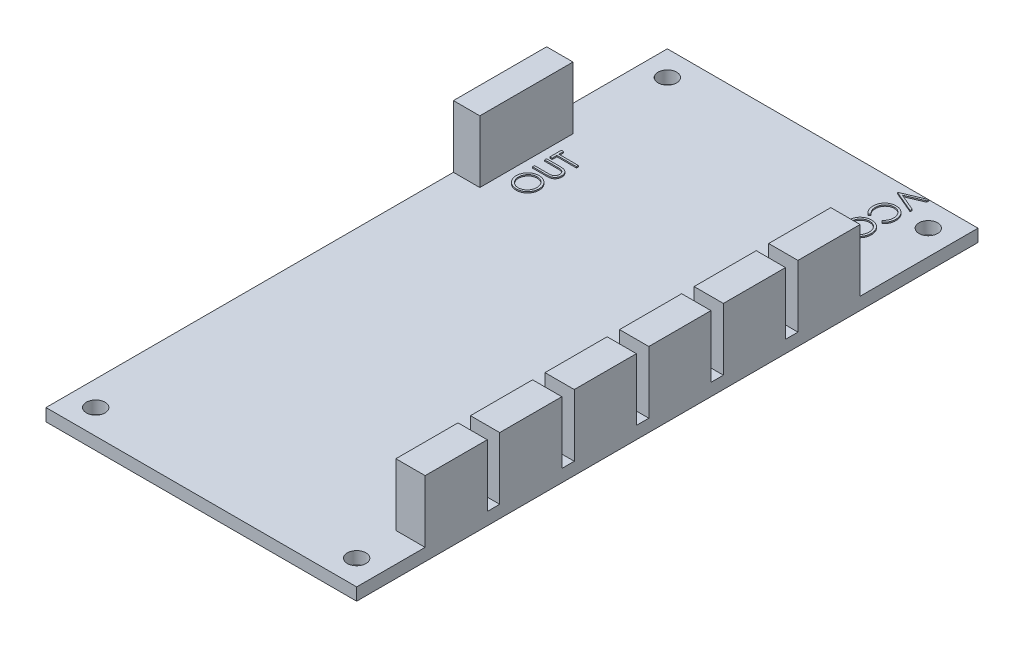
from build123d import *

# Parameters (mm, degrees)
SKIZZE1_W                       = 50
SKIZZE1_H                       = 100
SKIZZE1_R                       = 1.5
AUFSATZ_LINEAR_AUSTRAGEN1_DEPTH = 2
SKIZZE2_W                       = 4.251019897
SKIZZE2_H                       = 15
SKIZZE2_W_2                     = 4.710285564
SKIZZE2_H_2                     = 10
AUFSATZ_LINEAR_AUSTRAGEN2_DEPTH = 10
SKIZZE3_W                       = 3.5
SKIZZE3_H                       = 0.314102564
AUFSATZ_LINEAR_AUSTRAGEN3_DEPTH = 0.2


with BuildPart() as part:
    # Skizze1 → Aufsatz-Linear austragen1 (new body)
    with BuildSketch(Plane(origin=(0, 0, 0), x_dir=(1, 0, 0), z_dir=(0, 1, 0))):
        Rectangle(SKIZZE1_W, SKIZZE1_H)
        with Locations(Location((-21, -46, 0), (0, 0, 270))):
            Circle(SKIZZE1_R, mode=Mode.SUBTRACT)
        with Locations(Location((21, -46, 0), (0, 0, 270))):
            Circle(SKIZZE1_R, mode=Mode.SUBTRACT)
        with Locations(Location((-21, 46, 0), (0, 0, 90))):
            Circle(SKIZZE1_R, mode=Mode.SUBTRACT)
        with Locations(Location((21, 46, 0), (0, 0, 90))):
            Circle(SKIZZE1_R, mode=Mode.SUBTRACT)
    extrude(amount=AUFSATZ_LINEAR_AUSTRAGEN1_DEPTH)

    # Skizze2 → Aufsatz-Linear austragen2 (add)
    with BuildSketch(Plane(origin=(0, 2, 0), x_dir=(1, 0, 0), z_dir=(0, 1, 0))):
        with Locations((-22.874490052, 23.070720831)):
            Rectangle(SKIZZE2_W, SKIZZE2_H)
        with Locations((22.644857218, 26.019961823)):
            Rectangle(SKIZZE2_W_2, SKIZZE2_H_2)
        with Locations((22.644857218, 14.019961823)):
            Rectangle(SKIZZE2_W_2, SKIZZE2_H_2)
        with Locations((22.644857218, 2.019961823)):
            Rectangle(SKIZZE2_W_2, SKIZZE2_H_2)
        with Locations((22.644857218, -9.980038177)):
            Rectangle(SKIZZE2_W_2, SKIZZE2_H_2)
        with Locations((22.644857218, -21.980038177)):
            Rectangle(SKIZZE2_W_2, SKIZZE2_H_2)
        with Locations((22.644857218, -33.980038177)):
            Rectangle(SKIZZE2_W_2, SKIZZE2_H_2)
    extrude(amount=AUFSATZ_LINEAR_AUSTRAGEN2_DEPTH)

    # Skizze3 → Aufsatz-Linear austragen3 (add)
    # profile 1 of 23: a face of its own
    with BuildSketch(Plane(origin=(0, 2, 0), x_dir=(1, 0, 0), z_dir=(0, 1, 0))):
        Polygon((17.25727226, 49.820512821), (17.25727226, 49.483974359), (14.499059119, 48.317307692), (17.25727226, 47.150641026), (17.25727226, 46.814102564), (13.75727226, 48.294871795), (13.75727226, 48.33974359), align=None)
    # profile 2 of 23: a face of its own
    with BuildSketch(Plane(origin=(0, 2, 0), x_dir=(1, 0, 0), z_dir=(0, 1, 0))):
        with BuildLine():
            Line((16.615044695, 42.91025641), (16.404708157, 43.185096154))
            add(Edge.make_bspline(
                [(16.404708157, 43.185096154), (16.428074127, 43.204702042), (16.474491043, 43.243649489), (16.539670587, 43.306308692), (16.600735848, 43.371610334), (16.657977728, 43.439529456), (16.709394494, 43.511288575), (16.757665597, 43.585149374), (16.800933335, 43.662347419), (16.853396321, 43.769099154), (16.908142476, 43.908747002), (16.954045707, 44.084541841), (16.983266883, 44.26805294), (16.986431724, 44.393250539), (16.98804149, 44.45693109)],
                knots=[0, 0, 0, 0, 0.757959112, 1.505699292, 2.245454638, 2.979532153, 3.711538275, 4.438200793, 5.171680507, 5.909471876, 7.393775596, 8.890124382, 10.418191784, 12, 12, 12, 12], degree=3))
            add(Edge.make_bspline(
                [(16.98804149, 44.45693109), (16.987635705, 44.492013963), (16.986827901, 44.561854106), (16.976245676, 44.665508873), (16.961200939, 44.767424406), (16.93942056, 44.867221717), (16.911064482, 44.964702655), (16.877810371, 45.060609455), (16.836429005, 45.153812591), (16.790728811, 45.24543374), (16.739095991, 45.333208898), (16.682795727, 45.416276875), (16.622380598, 45.494258173), (16.558006554, 45.56736888), (16.488873555, 45.634807178), (16.415794868, 45.697653868), (16.337890901, 45.754776303), (16.256622678, 45.807578169), (16.171870749, 45.854562385), (16.084168275, 45.895135531), (15.993850575, 45.92991009), (15.900732626, 45.957681441), (15.805180871, 45.97958644), (15.706992527, 45.994719409), (15.606358183, 46.005206438), (15.53814896, 46.006006811), (15.503766651, 46.006410256)],
                knots=[0, 0, 0, 0, 1.055000685, 2.100209969, 3.131349012, 4.153242145, 5.170189196, 6.184191144, 7.204341339, 8.235672124, 9.263040994, 10.265373269, 11.252624173, 12.22887325, 13.193405896, 14.155809299, 15.126090485, 16.097288279, 17.069732292, 18.038585918, 19.002221264, 19.978698174, 20.959418239, 21.948869816, 22.966084182, 24, 24, 24, 24], degree=3))
            add(Edge.make_bspline(
                [(15.503766651, 46.006410256), (15.452035331, 46.005148437), (15.350467746, 46.002671023), (15.201697135, 45.980622689), (15.059176461, 45.947117598), (14.923796619, 45.896902021), (14.793888261, 45.83498297), (14.671649408, 45.756742359), (14.555232843, 45.666125821), (14.447389895, 45.561851402), (14.34887617, 45.447445586), (14.262125589, 45.324697674), (14.189810706, 45.193913387), (14.12963476, 45.056536756), (14.083378032, 44.911510642), (14.050813908, 44.75909584), (14.029571728, 44.599623845), (14.02753804, 44.490654445), (14.026503029, 44.435196314)],
                knots=[0, 0, 0, 0, 1.029171465, 2.020641659, 2.987623507, 3.938342917, 4.889210282, 5.84687017, 6.821220943, 7.821438502, 8.827599549, 9.822697543, 10.807740252, 11.797342354, 12.80366471, 13.83203677, 14.896651826, 16, 16, 16, 16], degree=3))
            add(Edge.make_bspline(
                [(14.026503029, 44.435196314), (14.028191809, 44.374093625), (14.031515731, 44.253828916), (14.05967498, 44.07746089), (14.105332898, 43.908625124), (14.16923082, 43.747312538), (14.252296108, 43.593977891), (14.352993986, 43.448381231), (14.472282318, 43.310399661), (14.563365447, 43.227428378), (14.609836362, 43.185096154)],
                knots=[0, 0, 0, 0, 1.028121516, 2.023589091, 2.998037872, 3.967518031, 4.937445131, 5.927275754, 6.942489185, 8, 8, 8, 8], degree=3))
            Line((14.609836362, 43.185096154), (14.401603189, 42.91025641))
            add(Edge.make_bspline(
                [(14.401603189, 42.91025641), (14.373064688, 42.932374491), (14.316124385, 42.976504707), (14.235853399, 43.04796316), (14.16034666, 43.123238831), (14.090229095, 43.202900593), (14.024036926, 43.285995692), (13.963989192, 43.373987806), (13.908256744, 43.46535714), (13.857900309, 43.56063566), (13.812750239, 43.659510554), (13.774633302, 43.761878925), (13.741326209, 43.866873502), (13.71410599, 43.974547161), (13.692826271, 44.08525961), (13.678608967, 44.198630992), (13.668866413, 44.314900622), (13.667978584, 44.393342077), (13.66752867, 44.433092949)],
                knots=[0, 0, 0, 0, 0.986756325, 1.968786143, 2.935506311, 3.899499537, 4.868307269, 5.8376204, 6.809456583, 7.792545619, 8.781780509, 9.778496008, 10.776623214, 11.79151764, 12.812666265, 13.856269958, 14.913646641, 16, 16, 16, 16], degree=3))
            add(Edge.make_bspline(
                [(13.66752867, 44.433092949), (13.667790662, 44.470736616), (13.66830872, 44.545172306), (13.676700888, 44.655071057), (13.688150625, 44.762060638), (13.705390756, 44.865835264), (13.725735096, 44.966961239), (13.753006352, 45.064521824), (13.783555519, 45.159477034), (13.819460506, 45.251445375), (13.859976688, 45.340505075), (13.905768247, 45.426368886), (13.956450112, 45.508997318), (14.010905122, 45.589202739), (14.070882424, 45.665800323), (14.135549059, 45.739453848), (14.204687069, 45.810576324), (14.254541923, 45.854579009), (14.279607997, 45.876702724)],
                knots=[0, 0, 0, 0, 1.114604814, 2.203992996, 3.262667896, 4.300477797, 5.318619304, 6.316056647, 7.298880507, 8.271930387, 9.238335007, 10.195173496, 11.151986948, 12.108099108, 13.064862484, 14.031167946, 15.010108607, 16, 16, 16, 16], degree=3))
            add(Edge.make_bspline(
                [(14.279607997, 45.876702724), (14.323149186, 45.912138368), (14.409705896, 45.982581845), (14.549991877, 46.072707528), (14.696460086, 46.149855083), (14.849880015, 46.212231004), (15.009907402, 46.260993737), (15.176622917, 46.294774932), (15.349870859, 46.316726537), (15.467707647, 46.319236826), (15.527604792, 46.320512821)],
                knots=[0, 0, 0, 0, 0.994628077, 1.977248131, 2.950237994, 3.925870899, 4.908910175, 5.911660606, 6.938484602, 8, 8, 8, 8], degree=3))
            add(Edge.make_bspline(
                [(15.527604792, 46.320512821), (15.590557611, 46.318950671), (15.714413354, 46.315877239), (15.8962249, 46.289980724), (16.070162568, 46.247816194), (16.236895627, 46.189755356), (16.395470094, 46.113157586), (16.546555697, 46.020429791), (16.69002907, 45.910666245), (16.824055891, 45.785245472), (16.946591979, 45.647670889), (17.054399036, 45.50035397), (17.144116327, 45.343571524), (17.21911255, 45.179053806), (17.276756997, 45.005568088), (17.317110188, 44.823484729), (17.342227303, 44.633145812), (17.345402511, 44.503283386), (17.347015849, 44.437299679)],
                knots=[0, 0, 0, 0, 1.032901378, 2.032168977, 3.007206631, 3.966850309, 4.924221947, 5.891988639, 6.871730993, 7.884084801, 8.900290346, 9.89161143, 10.874607481, 11.860025555, 12.854717796, 13.869097222, 14.917278314, 16, 16, 16, 16], degree=3))
            add(Edge.make_bspline(
                [(17.347015849, 44.437299679), (17.346534071, 44.397085129), (17.345580441, 44.317484475), (17.336269076, 44.199732965), (17.32077467, 44.085086439), (17.299546287, 43.973267641), (17.273527405, 43.863871092), (17.239466678, 43.75801912), (17.199913825, 43.65513532), (17.155521419, 43.555142639), (17.104770729, 43.459128967), (17.049650159, 43.367111776), (16.988887342, 43.280201087), (16.9244911, 43.196762102), (16.85405259, 43.118673297), (16.779865697, 43.043704477), (16.699729035, 42.974445345), (16.643324482, 42.931691889), (16.615044695, 42.91025641)],
                knots=[0, 0, 0, 0, 1.096705196, 2.170817488, 3.219277236, 4.250701065, 5.274195539, 6.284202015, 7.28098643, 8.279664616, 9.266225751, 10.241373748, 11.203306326, 12.157093976, 13.114198862, 14.069774147, 15.032234603, 16, 16, 16, 16], degree=3))
        make_face()
    # profile 3 of 23: a face of its own
    with BuildSketch(Plane(origin=(0, 2, 0), x_dir=(1, 0, 0), z_dir=(0, 1, 0))):
        with BuildLine():
            Line((16.615044695, 38.961538462), (16.404708157, 39.236378205))
            add(Edge.make_bspline(
                [(16.404708157, 39.236378205), (16.428074127, 39.255984093), (16.474491043, 39.29493154), (16.539670587, 39.357590743), (16.600735848, 39.422892386), (16.657977728, 39.490811507), (16.709394494, 39.562570626), (16.757665597, 39.636431425), (16.800933335, 39.71362947), (16.853396321, 39.820381205), (16.908142476, 39.960029053), (16.954045707, 40.135823892), (16.983266883, 40.319334991), (16.986431724, 40.44453259), (16.98804149, 40.508213141)],
                knots=[0, 0, 0, 0, 0.757959112, 1.505699292, 2.245454638, 2.979532153, 3.711538275, 4.438200793, 5.171680507, 5.909471876, 7.393775596, 8.890124382, 10.418191784, 12, 12, 12, 12], degree=3))
            add(Edge.make_bspline(
                [(16.98804149, 40.508213141), (16.987635705, 40.543296014), (16.986827901, 40.613136158), (16.976245676, 40.716790925), (16.961200939, 40.818706457), (16.93942056, 40.918503769), (16.911064482, 41.015984706), (16.877810371, 41.111891506), (16.836429005, 41.205094642), (16.790728811, 41.296715791), (16.739095991, 41.384490949), (16.682795727, 41.467558927), (16.622380598, 41.545540225), (16.558006554, 41.618650931), (16.488873555, 41.68608923), (16.415794868, 41.748935919), (16.337890901, 41.806058355), (16.256622678, 41.85886022), (16.171870749, 41.905844436), (16.084168275, 41.946417582), (15.993850575, 41.981192141), (15.900732626, 42.008963492), (15.805180871, 42.030868492), (15.706992527, 42.046001461), (15.606358183, 42.056488489), (15.53814896, 42.057288862), (15.503766651, 42.057692308)],
                knots=[0, 0, 0, 0, 1.055000685, 2.100209969, 3.131349012, 4.153242145, 5.170189196, 6.184191144, 7.204341339, 8.235672124, 9.263040994, 10.265373269, 11.252624173, 12.22887325, 13.193405896, 14.155809299, 15.126090485, 16.097288279, 17.069732292, 18.038585918, 19.002221264, 19.978698174, 20.959418239, 21.948869816, 22.966084182, 24, 24, 24, 24], degree=3))
            add(Edge.make_bspline(
                [(15.503766651, 42.057692308), (15.452035331, 42.056430489), (15.350467746, 42.053953074), (15.201697135, 42.03190474), (15.059176461, 41.998399649), (14.923796619, 41.948184072), (14.793888261, 41.886265022), (14.671649408, 41.80802441), (14.555232843, 41.717407873), (14.447389895, 41.613133453), (14.34887617, 41.498727637), (14.262125589, 41.375979726), (14.189810706, 41.245195438), (14.12963476, 41.107818808), (14.083378032, 40.962792694), (14.050813908, 40.810377891), (14.029571728, 40.650905896), (14.02753804, 40.541936496), (14.026503029, 40.486478365)],
                knots=[0, 0, 0, 0, 1.029171465, 2.020641659, 2.987623507, 3.938342917, 4.889210282, 5.84687017, 6.821220943, 7.821438502, 8.827599549, 9.822697543, 10.807740252, 11.797342354, 12.80366471, 13.83203677, 14.896651826, 16, 16, 16, 16], degree=3))
            add(Edge.make_bspline(
                [(14.026503029, 40.486478365), (14.028191809, 40.425375676), (14.031515731, 40.305110967), (14.05967498, 40.128742941), (14.105332898, 39.959907176), (14.16923082, 39.798594589), (14.252296108, 39.645259943), (14.352993986, 39.499663282), (14.472282318, 39.361681712), (14.563365447, 39.27871043), (14.609836362, 39.236378205)],
                knots=[0, 0, 0, 0, 1.028121516, 2.023589091, 2.998037872, 3.967518031, 4.937445131, 5.927275754, 6.942489185, 8, 8, 8, 8], degree=3))
            Line((14.609836362, 39.236378205), (14.401603189, 38.961538462))
            add(Edge.make_bspline(
                [(14.401603189, 38.961538462), (14.373064688, 38.983656542), (14.316124385, 39.027786759), (14.235853399, 39.099245211), (14.16034666, 39.174520882), (14.090229095, 39.254182644), (14.024036926, 39.337277743), (13.963989192, 39.425269857), (13.908256744, 39.516639191), (13.857900309, 39.611917711), (13.812750239, 39.710792605), (13.774633302, 39.813160976), (13.741326209, 39.918155553), (13.71410599, 40.025829212), (13.692826271, 40.136541661), (13.678608967, 40.249913044), (13.668866413, 40.366182674), (13.667978584, 40.444624128), (13.66752867, 40.484375)],
                knots=[0, 0, 0, 0, 0.986756325, 1.968786143, 2.935506311, 3.899499537, 4.868307269, 5.8376204, 6.809456583, 7.792545619, 8.781780509, 9.778496008, 10.776623214, 11.79151764, 12.812666265, 13.856269958, 14.913646641, 16, 16, 16, 16], degree=3))
            add(Edge.make_bspline(
                [(13.66752867, 40.484375), (13.667790662, 40.522018667), (13.66830872, 40.596454357), (13.676700888, 40.706353109), (13.688150625, 40.81334269), (13.705390756, 40.917117315), (13.725735096, 41.01824329), (13.753006352, 41.115803875), (13.783555519, 41.210759085), (13.819460506, 41.302727426), (13.859976688, 41.391787126), (13.905768247, 41.477650937), (13.956450112, 41.56027937), (14.010905122, 41.64048479), (14.070882424, 41.717082374), (14.135549059, 41.790735899), (14.204687069, 41.861858376), (14.254541923, 41.905861061), (14.279607997, 41.927984776)],
                knots=[0, 0, 0, 0, 1.114604814, 2.203992996, 3.262667896, 4.300477797, 5.318619304, 6.316056647, 7.298880507, 8.271930387, 9.238335007, 10.195173496, 11.151986948, 12.108099108, 13.064862484, 14.031167946, 15.010108607, 16, 16, 16, 16], degree=3))
            add(Edge.make_bspline(
                [(14.279607997, 41.927984776), (14.323149186, 41.963420419), (14.409705896, 42.033863896), (14.549991877, 42.12398958), (14.696460086, 42.201137135), (14.849880015, 42.263513056), (15.009907402, 42.312275789), (15.176622917, 42.346056984), (15.349870859, 42.368008588), (15.467707647, 42.370518877), (15.527604792, 42.371794872)],
                knots=[0, 0, 0, 0, 0.994628077, 1.977248131, 2.950237994, 3.925870899, 4.908910175, 5.911660606, 6.938484602, 8, 8, 8, 8], degree=3))
            add(Edge.make_bspline(
                [(15.527604792, 42.371794872), (15.590557611, 42.370232722), (15.714413354, 42.367159291), (15.8962249, 42.341262775), (16.070162568, 42.299098246), (16.236895627, 42.241037407), (16.395470094, 42.164439637), (16.546555697, 42.071711843), (16.69002907, 41.961948296), (16.824055891, 41.836527523), (16.946591979, 41.698952941), (17.054399036, 41.551636022), (17.144116327, 41.394853575), (17.21911255, 41.230335857), (17.276756997, 41.056850139), (17.317110188, 40.87476678), (17.342227303, 40.684427863), (17.345402511, 40.554565438), (17.347015849, 40.488581731)],
                knots=[0, 0, 0, 0, 1.032901378, 2.032168977, 3.007206631, 3.966850309, 4.924221947, 5.891988639, 6.871730993, 7.884084801, 8.900290346, 9.89161143, 10.874607481, 11.860025555, 12.854717796, 13.869097222, 14.917278314, 16, 16, 16, 16], degree=3))
            add(Edge.make_bspline(
                [(17.347015849, 40.488581731), (17.346534071, 40.44836718), (17.345580441, 40.368766527), (17.336269076, 40.251015016), (17.32077467, 40.136368491), (17.299546287, 40.024549692), (17.273527405, 39.915153144), (17.239466678, 39.809301171), (17.199913825, 39.706417372), (17.155521419, 39.606424691), (17.104770729, 39.510411018), (17.049650159, 39.418393828), (16.988887342, 39.331483138), (16.9244911, 39.248044153), (16.85405259, 39.169955349), (16.779865697, 39.094986528), (16.699729035, 39.025727397), (16.643324482, 38.98297394), (16.615044695, 38.961538462)],
                knots=[0, 0, 0, 0, 1.096705196, 2.170817488, 3.219277236, 4.250701065, 5.274195539, 6.284202015, 7.28098643, 8.279664616, 9.266225751, 10.241373748, 11.203306326, 12.157093976, 13.114198862, 14.069774147, 15.032234603, 16, 16, 16, 16], degree=3))
        make_face()
    # profile 4 of 23: a face of its own
    with BuildSketch(Plane(origin=(0, 2, 0), x_dir=(1, 0, 0), z_dir=(0, 1, 0))):
        Polygon((13.75727226, 20.872752432), (17.25727226, 20.410713169), (17.25727226, 20.365841374), (14.385477388, 18.920829355), (17.25727226, 17.479322945), (17.25727226, 17.433750028), (13.75727226, 16.968906278), (13.75727226, 17.284411086), (16.275701747, 17.619547304), (13.75727226, 18.882968778), (13.75727226, 18.95378208), (16.281310721, 20.222111407), (13.75727226, 20.556546503), align=None)
    # profile 5 of 23: a face of its own
    with BuildSketch(Plane(origin=(0, 2, 0), x_dir=(1, 0, 0), z_dir=(0, 1, 0))):
        Polygon((17.25727226, 16.25095756), (17.25727226, 14.276598586), (16.898297901, 14.276598586), (16.898297901, 15.936854996), (15.821374824, 15.936854996), (15.821374824, 14.276598586), (15.462400465, 14.276598586), (15.462400465, 15.936854996), (14.116246619, 15.936854996), (14.116246619, 14.276598586), (13.75727226, 14.276598586), (13.75727226, 16.25095756), align=None)
    # profile 6 of 23: a face of its own
    with BuildSketch(Plane(origin=(0, 2, 0), x_dir=(1, 0, 0), z_dir=(0, 1, 0))):
        Polygon((17.25727226, 12.212496022), (13.75727226, 10.597111407), (13.75727226, 10.938557721), (14.879067131, 11.455985605), (14.879067131, 13.042624227), (13.75727226, 13.574775669), (13.75727226, 13.917624227), (17.25727226, 12.257367817), align=None)
        Polygon((16.575080753, 12.238437528), (15.23804149, 12.872251631), (15.23804149, 11.621450349), align=None, mode=Mode.SUBTRACT)
    # profile 7 of 23: a face of its own
    with BuildSketch(Plane(origin=(0, 2, 0), x_dir=(1, 0, 0), z_dir=(0, 1, 0))):
        with BuildLine():
            Line((14.432452548, 10.417624227), (14.609836362, 10.12175083))
            add(Edge.make_bspline(
                [(14.609836362, 10.12175083), (14.563771977, 10.094232592), (14.475514393, 10.041508712), (14.356256353, 9.953557353), (14.254894196, 9.862424441), (14.172017589, 9.767435108), (14.106768702, 9.66916916), (14.06056647, 9.566985106), (14.031750495, 9.461227295), (14.028250408, 9.389253474), (14.026503029, 9.353321342)],
                knots=[0, 0, 0, 0, 1.272034388, 2.437168799, 3.508375237, 4.49857839, 5.41946034, 6.295179144, 7.148887113, 8, 8, 8, 8], degree=3))
            add(Edge.make_bspline(
                [(14.026503029, 9.353321342), (14.0273577, 9.322634479), (14.029052088, 9.261797699), (14.045332906, 9.172235503), (14.070344976, 9.085253525), (14.106166129, 9.002645543), (14.149503814, 8.925547561), (14.201852804, 8.857949186), (14.260449031, 8.79947355), (14.325867977, 8.751771805), (14.39598089, 8.714740631), (14.46859225, 8.687943849), (14.543382665, 8.670889309), (14.594088308, 8.668718608), (14.619652067, 8.667624227)],
                knots=[0, 0, 0, 0, 1.095270387, 2.171376115, 3.241375676, 4.322296363, 5.380636668, 6.392615365, 7.366724986, 8.328592944, 9.273498763, 10.190095884, 11.087518669, 12, 12, 12, 12], degree=3))
            add(Edge.make_bspline(
                [(14.619652067, 8.667624227), (14.648792917, 8.669098538), (14.708032006, 8.672095596), (14.795431659, 8.697427076), (14.881924229, 8.737276323), (14.935425495, 8.774038967), (14.963201747, 8.793125028)],
                knots=[0, 0, 0, 0, 0.938893495, 1.908633276, 2.914225137, 4, 4, 4, 4], degree=3))
            add(Edge.make_bspline(
                [(14.963201747, 8.793125028), (14.983289551, 8.808751279), (15.025585173, 8.841652935), (15.087490643, 8.898999622), (15.152906486, 8.964541344), (15.221567062, 9.03860576), (15.292218458, 9.122665118), (15.36633341, 9.21499336), (15.443689175, 9.316068432), (15.494843787, 9.387301575), (15.521294695, 9.424134644)],
                knots=[0, 0, 0, 0, 0.72226686, 1.520759855, 2.393439377, 3.351307446, 4.386958158, 5.510256019, 6.712608938, 8, 8, 8, 8], degree=3))
            add(Edge.make_bspline(
                [(15.521294695, 9.424134644), (15.547529286, 9.460953728), (15.597687827, 9.531349013), (15.672034499, 9.629871097), (15.740441652, 9.717853407), (15.801956399, 9.795744257), (15.859261702, 9.861528511), (15.909286317, 9.917611058), (15.954701501, 9.961922801), (15.984139471, 9.98658124), (15.997356394, 9.997652272)],
                knots=[0, 0, 0, 0, 1.452255772, 2.776602448, 3.96446981, 5.032613149, 5.964194703, 6.766668629, 7.446264616, 8, 8, 8, 8], degree=3))
            add(Edge.make_bspline(
                [(15.997356394, 9.997652272), (16.017957431, 10.013124817), (16.058472135, 10.043553654), (16.121796993, 10.083719659), (16.186620258, 10.117858822), (16.253116123, 10.144621154), (16.320351051, 10.167157373), (16.389202297, 10.182315304), (16.459360916, 10.191806701), (16.506574416, 10.192778687), (16.530208958, 10.193265253)],
                knots=[0, 0, 0, 0, 1.068054152, 2.10047183, 3.106115577, 4.101338837, 5.06977816, 6.043150881, 7.020423561, 8, 8, 8, 8], degree=3))
            add(Edge.make_bspline(
                [(16.530208958, 10.193265253), (16.567241833, 10.191965737), (16.640516032, 10.189394482), (16.747501879, 10.167471361), (16.849956506, 10.13327274), (16.94562315, 10.083811522), (17.034278093, 10.022659143), (17.114566833, 9.950386636), (17.182637763, 9.864578942), (17.241422928, 9.769906359), (17.287836275, 9.666948661), (17.323033871, 9.559254678), (17.342711482, 9.446352167), (17.345566962, 9.369752531), (17.347015849, 9.330885445)],
                knots=[0, 0, 0, 0, 1.005541892, 1.989591032, 2.955705311, 3.932863626, 4.905387107, 5.876519979, 6.856563935, 7.871847665, 8.897921447, 9.918317993, 10.943742853, 12, 12, 12, 12], degree=3))
            add(Edge.make_bspline(
                [(17.347015849, 9.330885445), (17.345619946, 9.289635197), (17.342851702, 9.207831022), (17.317920686, 9.087274975), (17.277649202, 8.970981204), (17.23126622, 8.877370416), (17.185148328, 8.80423329), (17.143125509, 8.748461524), (17.09475129, 8.691943786), (17.039891781, 8.634225816), (16.978045107, 8.576285131), (16.909634396, 8.517261686), (16.835077846, 8.457017415), (16.781853345, 8.418261556), (16.754567933, 8.398393458)],
                knots=[0, 0, 0, 0, 1.286821612, 2.551921131, 3.825787379, 5.12137259, 5.803616487, 6.523126609, 7.299589446, 8.125436757, 9.008162487, 9.944516264, 10.946261234, 12, 12, 12, 12], degree=3))
            Line((16.754567933, 8.398393458), (16.539323542, 8.682347785))
            add(Edge.make_bspline(
                [(16.539323542, 8.682347785), (16.561412233, 8.699493717), (16.603949887, 8.732512774), (16.663521194, 8.782642263), (16.717937702, 8.829890902), (16.765202738, 8.876441331), (16.80790517, 8.919834868), (16.844463945, 8.961952222), (16.875242729, 9.002185558), (16.908072981, 9.052906707), (16.940823586, 9.116792269), (16.967946678, 9.196908021), (16.984832693, 9.280403106), (16.986960134, 9.337115296), (16.98804149, 9.365941535)],
                knots=[0, 0, 0, 0, 1.181667846, 2.275615987, 3.290305621, 4.226321945, 5.078535498, 5.862783384, 6.581873284, 7.217493746, 8.414623899, 9.604724551, 10.782505457, 12, 12, 12, 12], degree=3))
            add(Edge.make_bspline(
                [(16.98804149, 9.365941535), (16.98682979, 9.402098057), (16.984493141, 9.471822505), (16.958973156, 9.570812741), (16.918791296, 9.659906666), (16.862476317, 9.736459231), (16.795755325, 9.800196208), (16.71897647, 9.846301667), (16.634194067, 9.874051831), (16.575052411, 9.877438111), (16.544932516, 9.879162689)],
                knots=[0, 0, 0, 0, 1.14458467, 2.207223713, 3.21896685, 4.227309161, 5.202851033, 6.127160689, 7.046193047, 8, 8, 8, 8], degree=3))
            add(Edge.make_bspline(
                [(16.544932516, 9.879162689), (16.526185818, 9.87875126), (16.488661768, 9.877927732), (16.43307713, 9.867216858), (16.377985898, 9.852029161), (16.323143103, 9.829801032), (16.267258527, 9.79986074), (16.210483052, 9.759150944), (16.151383232, 9.708221312), (16.112983081, 9.669131737), (16.092708958, 9.648493618)],
                knots=[0, 0, 0, 0, 0.858526328, 1.718456515, 2.587092892, 3.476767204, 4.426280253, 5.487868114, 6.673670035, 8, 8, 8, 8], degree=3))
            add(Edge.make_bspline(
                [(16.092708958, 9.648493618), (16.085871932, 9.640832246), (16.069628724, 9.622630579), (16.043036443, 9.589354653), (16.010233671, 9.545411855), (15.969646355, 9.491949653), (15.922564893, 9.427982292), (15.86959128, 9.353502736), (15.809005821, 9.269341203), (15.766648281, 9.209619287), (15.744251426, 9.178040894)],
                knots=[0, 0, 0, 0, 0.420754252, 0.999615792, 1.744751191, 2.668019286, 3.750313428, 4.999500688, 6.413464383, 8, 8, 8, 8], degree=3))
            add(Edge.make_bspline(
                [(15.744251426, 9.178040894), (15.716610067, 9.14005498), (15.663086405, 9.066500524), (15.582670725, 8.961842944), (15.504022956, 8.866949136), (15.427645349, 8.781485932), (15.354117256, 8.704609024), (15.282554076, 8.637171303), (15.213468503, 8.578485623), (15.124895928, 8.515306405), (15.016114843, 8.450748585), (14.882836605, 8.395307078), (14.749040284, 8.36034873), (14.659113448, 8.355777215), (14.614744215, 8.353521663)],
                knots=[0, 0, 0, 0, 1.163667725, 2.253281268, 3.268753668, 4.215851969, 5.092017293, 5.902905408, 6.650798638, 7.335211899, 8.59617414, 9.77448103, 10.901945474, 12, 12, 12, 12], degree=3))
            add(Edge.make_bspline(
                [(14.614744215, 8.353521663), (14.583366097, 8.354179166), (14.521219203, 8.355481404), (14.429960529, 8.370437009), (14.341343038, 8.392376417), (14.256381823, 8.425339714), (14.173940033, 8.465887682), (14.094777074, 8.515970242), (14.019981188, 8.576344737), (13.947995881, 8.643448542), (13.882972454, 8.718023173), (13.824816281, 8.796654985), (13.776139929, 8.879854464), (13.736955341, 8.967218915), (13.705822982, 9.058265056), (13.683445694, 9.153088702), (13.66968033, 9.25195391), (13.668253897, 9.319154984), (13.66752867, 9.353321342)],
                knots=[0, 0, 0, 0, 0.983610584, 1.948120116, 2.894308362, 3.843560551, 4.801159957, 5.773581695, 6.77566113, 7.813174769, 8.857584665, 9.875476876, 10.877851407, 11.875574773, 12.875048225, 13.892438445, 14.928473903, 16, 16, 16, 16], degree=3))
            add(Edge.make_bspline(
                [(13.66752867, 9.353321342), (13.668045709, 9.379755519), (13.669073275, 9.43229096), (13.677942406, 9.509788658), (13.690949096, 9.585863262), (13.710779586, 9.659559565), (13.735405905, 9.731795221), (13.76555727, 9.801926341), (13.801450936, 9.870123313), (13.843146357, 9.936465773), (13.891198861, 10.001578856), (13.946730529, 10.065128748), (14.009357793, 10.127842464), (14.079722911, 10.188570366), (14.157074103, 10.248431826), (14.242059496, 10.306313614), (14.334237926, 10.363394372), (14.39910286, 10.399209975), (14.432452548, 10.417624227)],
                knots=[0, 0, 0, 0, 0.915384692, 1.819241058, 2.699029451, 3.586605375, 4.459625921, 5.340865773, 6.228072412, 7.126546901, 8.052715223, 9.028303326, 10.047266019, 11.120332924, 12.245748783, 13.433636234, 14.680528497, 16, 16, 16, 16], degree=3))
        make_face()
    # profile 8 of 23: a face of its own
    with BuildSketch(Plane(origin=(0, 2, 0), x_dir=(1, 0, 0), z_dir=(0, 1, 0))):
        with BuildLine():
            Line((17.25727226, 7.635572945), (17.25727226, 7.321470381))
            Line((17.25727226, 7.321470381), (15.160216971, 7.321470381))
            add(Edge.make_bspline(
                [(15.160216971, 7.321470381), (15.130536235, 7.321517125), (15.074211924, 7.32160583), (14.994043624, 7.321013316), (14.922771165, 7.319353947), (14.860119817, 7.318307788), (14.80637707, 7.315980454), (14.761251759, 7.314082407), (14.724957557, 7.311641851), (14.703776631, 7.308708733), (14.694672099, 7.307447945)],
                knots=[0, 0, 0, 0, 1.528628734, 2.90083645, 4.128790002, 5.200304208, 6.127813768, 6.898992206, 7.526736466, 8, 8, 8, 8], degree=3))
            add(Edge.make_bspline(
                [(14.694672099, 7.307447945), (14.661822491, 7.302275512), (14.597974233, 7.292222093), (14.50710487, 7.266506962), (14.42492876, 7.230882745), (14.349807001, 7.187508277), (14.282856418, 7.131727678), (14.220699124, 7.065337674), (14.166999621, 6.984151297), (14.117596343, 6.893935843), (14.077945882, 6.796638023), (14.047948724, 6.697230021), (14.029670789, 6.597186212), (14.027554124, 6.530210155), (14.026503029, 6.49695115)],
                knots=[0, 0, 0, 0, 1.035924841, 2.013479024, 2.933602255, 3.82183108, 4.706948133, 5.639927629, 6.646101806, 7.731477349, 8.84205456, 9.913728764, 10.963998332, 12, 12, 12, 12], degree=3))
            add(Edge.make_bspline(
                [(14.026503029, 6.49695115), (14.02757682, 6.468397358), (14.0297182, 6.411454693), (14.042980515, 6.326849033), (14.066877706, 6.24444598), (14.097730269, 6.163856475), (14.138430428, 6.088264095), (14.185771441, 6.017722939), (14.240490788, 5.954091544), (14.301910898, 5.896707928), (14.370578537, 5.846465883), (14.446286812, 5.804074591), (14.528786845, 5.768346857), (14.586961234, 5.750837952), (14.61684758, 5.741842977)],
                knots=[0, 0, 0, 0, 0.994510594, 1.983277156, 2.972612928, 3.9776239, 4.982470102, 5.955333794, 6.930747147, 7.898149105, 8.876444039, 9.885893618, 10.913904934, 12, 12, 12, 12], degree=3))
            add(Edge.make_bspline(
                [(14.61684758, 5.741842977), (14.629196154, 5.738842852), (14.656713754, 5.732157364), (14.703235045, 5.725910319), (14.758124409, 5.719403793), (14.821776222, 5.714889223), (14.893977194, 5.710488003), (14.975103452, 5.70785493), (15.064860413, 5.706637897), (15.127497574, 5.706275217), (15.160216971, 5.706085765)],
                knots=[0, 0, 0, 0, 0.558680831, 1.244966039, 2.062412453, 2.990489873, 4.051219941, 5.244515665, 6.560634259, 8, 8, 8, 8], degree=3))
            Line((15.160216971, 5.706085765), (17.25727226, 5.706085765))
            Line((17.25727226, 5.706085765), (17.25727226, 5.391983201))
            Line((17.25727226, 5.391983201), (15.143390048, 5.391983201))
            add(Edge.make_bspline(
                [(15.143390048, 5.391983201), (15.105291259, 5.392234514), (15.030939156, 5.392724967), (14.921993492, 5.397064544), (14.818620393, 5.403783766), (14.720951759, 5.413941771), (14.628871279, 5.425155844), (14.542513483, 5.441200913), (14.461299321, 5.457974238), (14.385367842, 5.479190565), (14.313714395, 5.504784452), (14.244449062, 5.534750043), (14.178138061, 5.571417202), (14.113823685, 5.613259442), (14.051417828, 5.659715759), (13.99238603, 5.713262338), (13.934792936, 5.771126903), (13.880539022, 5.834528349), (13.830429779, 5.902333622), (13.787325808, 5.974663166), (13.749478053, 6.050060549), (13.719581983, 6.129333343), (13.696442299, 6.211965206), (13.679413117, 6.297951869), (13.669698147, 6.387585741), (13.668257959, 6.448551129), (13.66752867, 6.479423105)],
                knots=[0, 0, 0, 0, 1.316364231, 2.568964831, 3.766826305, 4.894964518, 5.961692026, 6.970710131, 7.928946231, 8.826316495, 9.692177228, 10.556379512, 11.43093279, 12.306715499, 13.20629939, 14.115652445, 15.057829886, 16.025681089, 16.996391533, 17.967202739, 18.931442607, 19.907779629, 20.889445314, 21.893507297, 22.933303057, 24, 24, 24, 24], degree=3))
            add(Edge.make_bspline(
                [(13.66752867, 6.479423105), (13.668313435, 6.513092208), (13.669853142, 6.579150867), (13.678675892, 6.676488934), (13.695294286, 6.76980313), (13.71645423, 6.860079007), (13.745637967, 6.946087504), (13.779736092, 7.028980949), (13.821613352, 7.10733963), (13.868206745, 7.182434759), (13.920631383, 7.252259515), (13.977771557, 7.316356918), (14.038711935, 7.374832788), (14.104112301, 7.426701485), (14.173464008, 7.472822369), (14.246963247, 7.512552583), (14.324581564, 7.546665827), (14.378534764, 7.564272394), (14.40580992, 7.573173105)],
                knots=[0, 0, 0, 0, 1.13879206, 2.234305948, 3.301075583, 4.341971843, 5.366689343, 6.369221514, 7.369726634, 8.367512178, 9.355451585, 10.318319045, 11.268648973, 12.207971039, 13.137398894, 14.081662264, 15.030215811, 16, 16, 16, 16], degree=3))
            add(Edge.make_bspline(
                [(14.40580992, 7.573173105), (14.424442494, 7.578350263), (14.464856963, 7.589579635), (14.531743452, 7.601604932), (14.608758369, 7.611714014), (14.695906988, 7.621219572), (14.793256854, 7.62682853), (14.90076577, 7.631745969), (15.018563732, 7.635607588), (15.100618248, 7.635584815), (15.143390048, 7.635572945)],
                knots=[0, 0, 0, 0, 0.625038921, 1.35572334, 2.194682327, 3.136881307, 4.189498639, 5.346923369, 6.617055217, 8, 8, 8, 8], degree=3))
            Line((15.143390048, 7.635572945), (17.25727226, 7.635572945))
        make_face()
    # profile 9 of 23: a face of its own
    with BuildSketch(Plane(origin=(0, 2, 0), x_dir=(1, 0, 0), z_dir=(0, 1, 0))):
        with BuildLine():
            Line((17.25727226, 4.449675509), (17.25727226, 3.749254836))
            add(Edge.make_bspline(
                [(17.25727226, 3.749254836), (17.257116674, 3.702513707), (17.256817931, 3.612765563), (17.255152168, 3.484192293), (17.250377813, 3.367365196), (17.246269229, 3.262345356), (17.238777288, 3.169134701), (17.231616641, 3.087447411), (17.22224298, 3.017659713), (17.213537557, 2.975413862), (17.209595978, 2.956286086)],
                knots=[0, 0, 0, 0, 1.410062039, 2.707475311, 3.878576406, 4.937260626, 5.877586885, 6.699081471, 7.410979367, 8, 8, 8, 8], degree=3))
            add(Edge.make_bspline(
                [(17.209595978, 2.956286086), (17.20326993, 2.930679011), (17.190752786, 2.880011129), (17.164282773, 2.807067606), (17.133701564, 2.737529141), (17.097504006, 2.67165669), (17.056321462, 2.609444143), (17.009913318, 2.550984649), (16.958043234, 2.496612438), (16.902035754, 2.445909141), (16.841402196, 2.399948235), (16.777025827, 2.360175084), (16.709309283, 2.326117534), (16.63801675, 2.298928368), (16.563750889, 2.277055517), (16.48586322, 2.261627866), (16.404701933, 2.252377068), (16.349344067, 2.251435159), (16.321274663, 2.25095756)],
                knots=[0, 0, 0, 0, 1.02737288, 2.032829108, 3.019628684, 3.985738875, 4.958353778, 5.924249254, 6.890702889, 7.883913451, 8.865824512, 9.85161466, 10.829249435, 11.81541824, 12.821369441, 13.843154991, 14.906364023, 16, 16, 16, 16], degree=3))
            add(Edge.make_bspline(
                [(16.321274663, 2.25095756), (16.274639505, 2.25242652), (16.183642233, 2.255292842), (16.051582101, 2.282018478), (15.928390045, 2.32579305), (15.814237506, 2.386123514), (15.711289486, 2.462916438), (15.621172714, 2.55520407), (15.545064994, 2.662515104), (15.49284839, 2.762883658), (15.459249989, 2.851586042), (15.435491357, 2.924825712), (15.41744438, 3.004778476), (15.4010422, 3.09029729), (15.388526019, 3.182042711), (15.379637151, 3.279829985), (15.373921542, 3.383903684), (15.373086467, 3.455243445), (15.372656875, 3.491943137)],
                knots=[0, 0, 0, 0, 1.260402266, 2.459371274, 3.627181936, 4.786749125, 5.93865593, 7.087644312, 8.261344208, 9.485713728, 10.136162886, 10.825977872, 11.566646758, 12.35154167, 13.181268117, 14.0701832, 15.007234106, 16, 16, 16, 16], degree=3))
            Line((15.372656875, 3.491943137), (13.75727226, 2.206085765))
            Line((13.75727226, 2.206085765), (13.75727226, 2.59450724))
            Line((13.75727226, 2.59450724), (15.372656875, 3.880364612))
            Line((15.372656875, 3.880364612), (15.372656875, 4.135572945))
            Line((15.372656875, 4.135572945), (13.75727226, 4.135572945))
            Line((13.75727226, 4.135572945), (13.75727226, 4.449675509))
            Line((13.75727226, 4.449675509), (17.25727226, 4.449675509))
        make_face()
        with BuildLine():
            Line((16.898297901, 4.135572945), (15.731631234, 4.135572945))
            Line((15.731631234, 4.135572945), (15.726723381, 3.494747624))
            add(Edge.make_bspline(
                [(15.726723381, 3.494747624), (15.726710145, 3.464827586), (15.726684489, 3.406834029), (15.730678264, 3.322933362), (15.735221586, 3.244813256), (15.742170917, 3.172772485), (15.751127037, 3.106778973), (15.762329864, 3.046865354), (15.77538244, 2.99293497), (15.795581903, 2.930033619), (15.827602542, 2.859816103), (15.874110695, 2.78341006), (15.932986321, 2.718564887), (15.999239686, 2.662655779), (16.073582073, 2.619591526), (16.152713703, 2.588248306), (16.235951406, 2.568578689), (16.29312325, 2.566240249), (16.321975785, 2.565060124)],
                knots=[0, 0, 0, 0, 1.14660753, 2.222451964, 3.218720504, 4.145691244, 4.995719623, 5.770487122, 6.480909919, 7.121111896, 8.299844659, 9.430703709, 10.534634535, 11.641396424, 12.741395289, 13.810956493, 14.895269934, 16, 16, 16, 16], degree=3))
            add(Edge.make_bspline(
                [(16.321975785, 2.565060124), (16.350130164, 2.566243877), (16.405921871, 2.568589642), (16.487375307, 2.588286417), (16.564802169, 2.620093828), (16.636726647, 2.66469518), (16.702558639, 2.718589073), (16.758107556, 2.782596085), (16.804626537, 2.853492744), (16.83413668, 2.919802966), (16.85226523, 2.979031122), (16.865006394, 3.030463229), (16.875329243, 3.088797999), (16.883355063, 3.153895631), (16.890577383, 3.225638352), (16.895260145, 3.304222607), (16.898090406, 3.38955765), (16.898227126, 3.448704832), (16.898297901, 3.479322945)],
                knots=[0, 0, 0, 0, 1.100801541, 2.181386982, 3.260112282, 4.364594493, 5.481957178, 6.577424609, 7.668452592, 8.790448866, 9.403819393, 10.091598921, 10.863153553, 11.720938239, 12.658472417, 13.685008818, 14.801622349, 16, 16, 16, 16], degree=3))
            Line((16.898297901, 3.479322945), (16.898297901, 4.135572945))
        make_face(mode=Mode.SUBTRACT)
    # profile 10 of 23: a face of its own
    with BuildSketch(Plane(origin=(0, 2, 0), x_dir=(1, 0, 0), z_dir=(0, 1, 0))):
        Polygon((17.25727226, 1.488137048), (17.25727226, -0.486221927), (16.898297901, -0.486221927), (16.898297901, 1.174034483), (15.821374824, 1.174034483), (15.821374824, -0.486221927), (15.462400465, -0.486221927), (15.462400465, 1.174034483), (14.116246619, 1.174034483), (14.116246619, -0.486221927), (13.75727226, -0.486221927), (13.75727226, 1.488137048), align=None)
    # profile 11 of 23: a face of its own
    with BuildSketch(Plane(origin=(0, 2, 0), x_dir=(1, 0, 0), z_dir=(0, 1, 0))):
        Polygon((13.75727226, -0.934939876), (17.25727226, -1.396979138), (17.25727226, -1.441850933), (14.385477388, -2.886862952), (17.25727226, -4.328369363), (17.25727226, -4.373942279), (13.75727226, -4.838786029), (13.75727226, -4.523281222), (16.275701747, -4.188145004), (13.75727226, -2.924723529), (13.75727226, -2.853910228), (16.281310721, -1.585580901), (13.75727226, -1.251145805), align=None)
    # profile 12 of 23: a face of its own
    with BuildSketch(Plane(origin=(0, 2, 0), x_dir=(1, 0, 0), z_dir=(0, 1, 0))):
        Polygon((17.25727226, -5.556734747), (17.25727226, -7.531093722), (16.898297901, -7.531093722), (16.898297901, -5.870837311), (15.821374824, -5.870837311), (15.821374824, -7.531093722), (15.462400465, -7.531093722), (15.462400465, -5.870837311), (14.116246619, -5.870837311), (14.116246619, -7.531093722), (13.75727226, -7.531093722), (13.75727226, -5.556734747), align=None)
    # profile 13 of 23: a face of its own
    with BuildSketch(Plane(origin=(0, 2, 0), x_dir=(1, 0, 0), z_dir=(0, 1, 0))):
        Polygon((13.75727226, -8.15929885), (17.25727226, -8.15929885), (17.25727226, -8.225204299), (14.502564728, -10.537503978), (17.25727226, -10.537503978), (17.25727226, -10.851606542), (13.75727226, -10.851606542), (13.75727226, -10.780092119), (16.505669695, -8.473401414), (13.75727226, -8.473401414), align=None)
    # profile 14 of 23: a face of its own
    with BuildSketch(Plane(origin=(0, 2, 0), x_dir=(1, 0, 0), z_dir=(0, 1, 0))):
        Polygon((16.898297901, -11.345196286), (17.25727226, -11.345196286), (17.25727226, -13.184939876), (16.898297901, -13.184939876), (16.898297901, -12.422119363), (13.75727226, -12.422119363), (13.75727226, -12.108016799), (16.898297901, -12.108016799), align=None)
    # profile 15 of 23: a face of its own
    with BuildSketch(Plane(origin=(0, 2, 0), x_dir=(1, 0, 0), z_dir=(0, 1, 0))):
        with Locations((15.50727226, -15.316350132)):
            Rectangle(SKIZZE3_W, SKIZZE3_H)
    # profile 16 of 23: a face of its own
    with BuildSketch(Plane(origin=(0, 2, 0), x_dir=(1, 0, 0), z_dir=(0, 1, 0))):
        Polygon((13.75727226, -16.236221927), (17.25727226, -16.236221927), (17.25727226, -16.302127376), (14.502564728, -18.614427055), (17.25727226, -18.614427055), (17.25727226, -18.928529619), (13.75727226, -18.928529619), (13.75727226, -18.857015196), (16.505669695, -16.550324491), (13.75727226, -16.550324491), align=None)
    # profile 17 of 23: a face of its own
    with BuildSketch(Plane(origin=(0, 2, 0), x_dir=(1, 0, 0), z_dir=(0, 1, 0))):
        with BuildLine():
            Line((17.25727226, -19.825965517), (17.25727226, -20.512363754))
            add(Edge.make_bspline(
                [(17.25727226, -20.512363754), (17.257220363, -20.55957466), (17.257120928, -20.650032853), (17.254106182, -20.779747908), (17.25007949, -20.89755764), (17.244497597, -21.003208021), (17.237901006, -21.097024119), (17.228648967, -21.178581419), (17.218988672, -21.248520975), (17.209167265, -21.290427424), (17.204688125, -21.309539235)],
                knots=[0, 0, 0, 0, 1.415646017, 2.712440637, 3.8905458, 4.950247383, 5.884950622, 6.709939814, 7.411656543, 8, 8, 8, 8], degree=3))
            add(Edge.make_bspline(
                [(17.204688125, -21.309539235), (17.198066234, -21.333732825), (17.184978489, -21.381549915), (17.158763911, -21.450450132), (17.127684919, -21.516007045), (17.092249249, -21.578427264), (17.051007052, -21.637011271), (17.005262937, -21.692508982), (16.955042072, -21.745238715), (16.899370887, -21.793409257), (16.840301963, -21.837756426), (16.776519802, -21.875799569), (16.7094126, -21.907979046), (16.638293096, -21.934259878), (16.563593536, -21.954243448), (16.485095848, -21.96900794), (16.403069757, -21.978454445), (16.347008695, -21.979353829), (16.318470176, -21.97981167)],
                knots=[0, 0, 0, 0, 0.999487232, 1.975422798, 2.933948774, 3.889618007, 4.832992075, 5.786114792, 6.754729845, 7.731954186, 8.717668599, 9.695514499, 10.68728626, 11.680675814, 12.71351902, 13.766008651, 14.862761406, 16, 16, 16, 16], degree=3))
            add(Edge.make_bspline(
                [(16.318470176, -21.97981167), (16.289692399, -21.979390246), (16.233386735, -21.9785657), (16.151013947, -21.968669414), (16.072295557, -21.955339223), (15.997406107, -21.93484217), (15.926790336, -21.907996497), (15.859369104, -21.876504445), (15.796289432, -21.838520914), (15.737322315, -21.794876084), (15.682412402, -21.74632449), (15.631957608, -21.693071552), (15.58625327, -21.635332259), (15.545196926, -21.573290111), (15.509740646, -21.506340262), (15.477983341, -21.435498109), (15.451312281, -21.360147892), (15.437282219, -21.308005379), (15.430148862, -21.281494363)],
                knots=[0, 0, 0, 0, 1.121902311, 2.195077645, 3.232258892, 4.234102512, 5.217864754, 6.176164875, 7.132989551, 8.084763148, 9.034132444, 9.988522005, 10.94243251, 11.903244335, 12.886203696, 13.894208494, 14.929344452, 16, 16, 16, 16], degree=3))
            add(Edge.make_bspline(
                [(15.430148862, -21.281494363), (15.425485881, -21.259567029), (15.415266687, -21.211512001), (15.40385823, -21.132369279), (15.394120629, -21.040223893), (15.386819492, -20.935201613), (15.380569123, -20.817396708), (15.375601029, -20.686745451), (15.372871176, -20.542991374), (15.372730383, -20.44272013), (15.372656875, -20.390368561)],
                knots=[0, 0, 0, 0, 0.601384939, 1.31797006, 2.144135048, 3.087295005, 4.142315834, 5.309527816, 6.595305764, 8, 8, 8, 8], degree=3))
            Line((15.372656875, -20.390368561), (15.372656875, -20.140068081))
            Line((15.372656875, -20.140068081), (13.75727226, -20.140068081))
            Line((13.75727226, -20.140068081), (13.75727226, -19.825965517))
            Line((13.75727226, -19.825965517), (17.25727226, -19.825965517))
        make_face()
        with BuildLine():
            Line((16.898297901, -20.140068081), (15.731631234, -20.140068081))
            Line((15.731631234, -20.140068081), (15.723918894, -20.752848529))
            add(Edge.make_bspline(
                [(15.723918894, -20.752848529), (15.723900184, -20.782768748), (15.723864063, -20.840529113), (15.727903969, -20.924194442), (15.732360255, -21.001617441), (15.73933899, -21.072966242), (15.74853413, -21.137695596), (15.758542864, -21.196636928), (15.772102707, -21.248927369), (15.791009751, -21.310202191), (15.822627606, -21.378249287), (15.869704284, -21.451785818), (15.928064348, -21.51511576), (15.994582931, -21.569552599), (16.068851182, -21.611741006), (16.147690396, -21.643472066), (16.231150182, -21.661955227), (16.288233978, -21.664449306), (16.317067933, -21.665709106)],
                knots=[0, 0, 0, 0, 1.160368111, 2.240066715, 3.248291599, 4.168343349, 5.019594299, 5.784185847, 6.485545725, 7.113397927, 8.269509094, 9.383373363, 10.487084095, 11.595623793, 12.704274681, 13.786671823, 14.88201193, 16, 16, 16, 16], degree=3))
            add(Edge.make_bspline(
                [(16.317067933, -21.665709106), (16.345204259, -21.664442579), (16.401135795, -21.66192488), (16.483146817, -21.643326273), (16.561149576, -21.611802948), (16.634503492, -21.569266724), (16.700749848, -21.51639294), (16.757792815, -21.454466449), (16.804272816, -21.384751749), (16.834066005, -21.319868563), (16.852287147, -21.262272492), (16.865030566, -21.212239292), (16.875206622, -21.15574901), (16.883445986, -21.092781109), (16.89049949, -21.023824313), (16.895285454, -20.948285987), (16.898086914, -20.866452347), (16.898225869, -20.809641775), (16.898297901, -20.780192279)],
                knots=[0, 0, 0, 0, 1.120550889, 2.227516482, 3.330715807, 4.461473166, 5.594337325, 6.694900473, 7.802844763, 8.919519911, 9.52614448, 10.208195984, 10.975273469, 11.811520316, 12.738076669, 13.736566072, 14.826679847, 16, 16, 16, 16], degree=3))
            Line((16.898297901, -20.780192279), (16.898297901, -20.140068081))
        make_face(mode=Mode.SUBTRACT)
    # profile 18 of 23: a face of its own
    with BuildSketch(Plane(origin=(0, 2, 0), x_dir=(1, 0, 0), z_dir=(0, 1, 0))):
        with BuildLine():
            Line((17.25727226, -22.697760388), (17.25727226, -23.011862952))
            Line((17.25727226, -23.011862952), (15.160216971, -23.011862952))
            add(Edge.make_bspline(
                [(15.160216971, -23.011862952), (15.130536235, -23.011816208), (15.074211924, -23.011727504), (14.994043624, -23.012320018), (14.922771165, -23.013979386), (14.860119817, -23.015025546), (14.80637707, -23.017352879), (14.761251759, -23.019250926), (14.724957557, -23.021691483), (14.703776631, -23.0246246), (14.694672099, -23.025885388)],
                knots=[0, 0, 0, 0, 1.528628734, 2.90083645, 4.128790002, 5.200304208, 6.127813768, 6.898992206, 7.526736466, 8, 8, 8, 8], degree=3))
            add(Edge.make_bspline(
                [(14.694672099, -23.025885388), (14.661822491, -23.031057822), (14.597974233, -23.04111124), (14.50710487, -23.066826371), (14.42492876, -23.102450588), (14.349807001, -23.145825056), (14.282856418, -23.201605655), (14.220699124, -23.267995659), (14.166999621, -23.349182036), (14.117596343, -23.43939749), (14.077945882, -23.536695311), (14.047948724, -23.636103312), (14.029670789, -23.736147122), (14.027554124, -23.803123178), (14.026503029, -23.836382183)],
                knots=[0, 0, 0, 0, 1.035924841, 2.013479024, 2.933602255, 3.82183108, 4.706948133, 5.639927629, 6.646101806, 7.731477349, 8.84205456, 9.913728764, 10.963998332, 12, 12, 12, 12], degree=3))
            add(Edge.make_bspline(
                [(14.026503029, -23.836382183), (14.02757682, -23.864935975), (14.0297182, -23.921878641), (14.042980515, -24.0064843), (14.066877706, -24.088887353), (14.097730269, -24.169476858), (14.138430428, -24.245069238), (14.185771441, -24.315610394), (14.240490788, -24.379241789), (14.301910898, -24.436625405), (14.370578537, -24.486867451), (14.446286812, -24.529258742), (14.528786845, -24.564986476), (14.586961234, -24.582495381), (14.61684758, -24.591490356)],
                knots=[0, 0, 0, 0, 0.994510594, 1.983277156, 2.972612928, 3.9776239, 4.982470102, 5.955333794, 6.930747147, 7.898149105, 8.876444039, 9.885893618, 10.913904934, 12, 12, 12, 12], degree=3))
            add(Edge.make_bspline(
                [(14.61684758, -24.591490356), (14.629196154, -24.594490482), (14.656713754, -24.60117597), (14.703235045, -24.607423015), (14.758124409, -24.61392954), (14.821776222, -24.61844411), (14.893977194, -24.622845331), (14.975103452, -24.625478403), (15.064860413, -24.626695436), (15.127497574, -24.627058117), (15.160216971, -24.627247568)],
                knots=[0, 0, 0, 0, 0.558680831, 1.244966039, 2.062412453, 2.990489873, 4.051219941, 5.244515665, 6.560634259, 8, 8, 8, 8], degree=3))
            Line((15.160216971, -24.627247568), (17.25727226, -24.627247568))
            Line((17.25727226, -24.627247568), (17.25727226, -24.941350132))
            Line((17.25727226, -24.941350132), (15.143390048, -24.941350132))
            add(Edge.make_bspline(
                [(15.143390048, -24.941350132), (15.105291259, -24.941098819), (15.030939156, -24.940608366), (14.921993492, -24.93626879), (14.818620393, -24.929549568), (14.720951759, -24.919391562), (14.628871279, -24.908177489), (14.542513483, -24.892132421), (14.461299321, -24.875359096), (14.385367842, -24.854142768), (14.313714395, -24.828548881), (14.244449062, -24.79858329), (14.178138061, -24.761916132), (14.113823685, -24.720073891), (14.051417828, -24.673617574), (13.99238603, -24.620070995), (13.934792936, -24.562206431), (13.880539022, -24.498804984), (13.830429779, -24.430999712), (13.787325808, -24.358670168), (13.749478053, -24.283272784), (13.719581983, -24.203999991), (13.696442299, -24.121368128), (13.679413117, -24.035381465), (13.669698147, -23.945747592), (13.668257959, -23.884782204), (13.66752867, -23.853910228)],
                knots=[0, 0, 0, 0, 1.316364231, 2.568964831, 3.766826305, 4.894964518, 5.961692026, 6.970710131, 7.928946231, 8.826316495, 9.692177228, 10.556379512, 11.43093279, 12.306715499, 13.20629939, 14.115652445, 15.057829886, 16.025681089, 16.996391533, 17.967202739, 18.931442607, 19.907779629, 20.889445314, 21.893507297, 22.933303057, 24, 24, 24, 24], degree=3))
            add(Edge.make_bspline(
                [(13.66752867, -23.853910228), (13.668313435, -23.820241125), (13.669853142, -23.754182467), (13.678675892, -23.656844399), (13.695294286, -23.563530203), (13.71645423, -23.473254326), (13.745637967, -23.387245829), (13.779736092, -23.304352384), (13.821613352, -23.225993703), (13.868206745, -23.150898575), (13.920631383, -23.081073819), (13.977771557, -23.016976415), (14.038711935, -22.958500545), (14.104112301, -22.906631849), (14.173464008, -22.860510964), (14.246963247, -22.820780751), (14.324581564, -22.786667506), (14.378534764, -22.769060939), (14.40580992, -22.760160228)],
                knots=[0, 0, 0, 0, 1.13879206, 2.234305948, 3.301075583, 4.341971843, 5.366689343, 6.369221514, 7.369726634, 8.367512178, 9.355451585, 10.318319045, 11.268648973, 12.207971039, 13.137398894, 14.081662264, 15.030215811, 16, 16, 16, 16], degree=3))
            add(Edge.make_bspline(
                [(14.40580992, -22.760160228), (14.424442494, -22.75498307), (14.464856963, -22.743753699), (14.531743452, -22.731728401), (14.608758369, -22.721619319), (14.695906988, -22.712113761), (14.793256854, -22.706504803), (14.90076577, -22.701587364), (15.018563732, -22.697725746), (15.100618248, -22.697748518), (15.143390048, -22.697760388)],
                knots=[0, 0, 0, 0, 0.625038921, 1.35572334, 2.194682327, 3.136881307, 4.189498639, 5.346923369, 6.617055217, 8, 8, 8, 8], degree=3))
            Line((15.143390048, -22.697760388), (17.25727226, -22.697760388))
        make_face()
    # profile 19 of 23: a face of its own
    with BuildSketch(Plane(origin=(0, 2, 0), x_dir=(1, 0, 0), z_dir=(0, 1, 0))):
        Polygon((16.898297901, -25.47981167), (17.25727226, -25.47981167), (17.25727226, -27.31955526), (16.898297901, -27.31955526), (16.898297901, -26.556734747), (13.75727226, -26.556734747), (13.75727226, -26.242632183), (16.898297901, -26.242632183), align=None)
    # profile 20 of 23: a face of its own
    with BuildSketch(Plane(origin=(0, 2, 0), x_dir=(1, 0, 0), z_dir=(0, 1, 0))):
        with BuildLine():
            Line((14.432452548, -27.588786029), (14.609836362, -27.884659427))
            add(Edge.make_bspline(
                [(14.609836362, -27.884659427), (14.563771977, -27.912177664), (14.475514393, -27.964901545), (14.356256353, -28.052852904), (14.254894196, -28.143985815), (14.172017589, -28.238975149), (14.106768702, -28.337241097), (14.06056647, -28.43942515), (14.031750495, -28.545182961), (14.028250408, -28.617156783), (14.026503029, -28.653088914)],
                knots=[0, 0, 0, 0, 1.272034388, 2.437168799, 3.508375237, 4.49857839, 5.41946034, 6.295179144, 7.148887113, 8, 8, 8, 8], degree=3))
            add(Edge.make_bspline(
                [(14.026503029, -28.653088914), (14.0273577, -28.683775778), (14.029052088, -28.744612557), (14.045332906, -28.834174754), (14.070344976, -28.921156731), (14.106166129, -29.003764713), (14.149503814, -29.080862695), (14.201852804, -29.148461071), (14.260449031, -29.206936707), (14.325867977, -29.254638452), (14.39598089, -29.291669626), (14.46859225, -29.318466408), (14.543382665, -29.335520948), (14.594088308, -29.337691649), (14.619652067, -29.338786029)],
                knots=[0, 0, 0, 0, 1.095270387, 2.171376115, 3.241375676, 4.322296363, 5.380636668, 6.392615365, 7.366724986, 8.328592944, 9.273498763, 10.190095884, 11.087518669, 12, 12, 12, 12], degree=3))
            add(Edge.make_bspline(
                [(14.619652067, -29.338786029), (14.648792917, -29.337311719), (14.708032006, -29.33431466), (14.795431659, -29.30898318), (14.881924229, -29.269133934), (14.935425495, -29.23237129), (14.963201747, -29.213285228)],
                knots=[0, 0, 0, 0, 0.938893495, 1.908633276, 2.914225137, 4, 4, 4, 4], degree=3))
            add(Edge.make_bspline(
                [(14.963201747, -29.213285228), (14.983289551, -29.197658977), (15.025585173, -29.164757322), (15.087490643, -29.107410634), (15.152906486, -29.041868912), (15.221567062, -28.967804496), (15.292218458, -28.883745139), (15.36633341, -28.791416897), (15.443689175, -28.690341825), (15.494843787, -28.619108682), (15.521294695, -28.582275613)],
                knots=[0, 0, 0, 0, 0.72226686, 1.520759855, 2.393439377, 3.351307446, 4.386958158, 5.510256019, 6.712608938, 8, 8, 8, 8], degree=3))
            add(Edge.make_bspline(
                [(15.521294695, -28.582275613), (15.547529286, -28.545456528), (15.597687827, -28.475061243), (15.672034499, -28.376539159), (15.740441652, -28.288556849), (15.801956399, -28.210666), (15.859261702, -28.144881746), (15.909286317, -28.088799199), (15.954701501, -28.044487456), (15.984139471, -28.019829016), (15.997356394, -28.008757985)],
                knots=[0, 0, 0, 0, 1.452255772, 2.776602448, 3.96446981, 5.032613149, 5.964194703, 6.766668629, 7.446264616, 8, 8, 8, 8], degree=3))
            add(Edge.make_bspline(
                [(15.997356394, -28.008757985), (16.017957431, -27.993285439), (16.058472135, -27.962856603), (16.121796993, -27.922690597), (16.186620258, -27.888551434), (16.253116123, -27.861789102), (16.320351051, -27.839252883), (16.389202297, -27.824094953), (16.459360916, -27.814603556), (16.506574416, -27.813631569), (16.530208958, -27.813145004)],
                knots=[0, 0, 0, 0, 1.068054152, 2.10047183, 3.106115577, 4.101338837, 5.06977816, 6.043150881, 7.020423561, 8, 8, 8, 8], degree=3))
            add(Edge.make_bspline(
                [(16.530208958, -27.813145004), (16.567241833, -27.814444519), (16.640516032, -27.817015774), (16.747501879, -27.838938895), (16.849956506, -27.873137516), (16.94562315, -27.922598734), (17.034278093, -27.983751114), (17.114566833, -28.056023621), (17.182637763, -28.141831314), (17.241422928, -28.236503898), (17.287836275, -28.339461595), (17.323033871, -28.447155578), (17.342711482, -28.560058089), (17.345566962, -28.636657725), (17.347015849, -28.675524811)],
                knots=[0, 0, 0, 0, 1.005541892, 1.989591032, 2.955705311, 3.932863626, 4.905387107, 5.876519979, 6.856563935, 7.871847665, 8.897921447, 9.918317993, 10.943742853, 12, 12, 12, 12], degree=3))
            add(Edge.make_bspline(
                [(17.347015849, -28.675524811), (17.345619946, -28.71677506), (17.342851702, -28.798579235), (17.317920686, -28.919135282), (17.277649202, -29.035429053), (17.23126622, -29.12903984), (17.185148328, -29.202176967), (17.143125509, -29.257948733), (17.09475129, -29.314466471), (17.039891781, -29.372184441), (16.978045107, -29.430125125), (16.909634396, -29.48914857), (16.835077846, -29.549392841), (16.781853345, -29.588148701), (16.754567933, -29.608016799)],
                knots=[0, 0, 0, 0, 1.286821612, 2.551921131, 3.825787379, 5.12137259, 5.803616487, 6.523126609, 7.299589446, 8.125436757, 9.008162487, 9.944516264, 10.946261234, 12, 12, 12, 12], degree=3))
            Line((16.754567933, -29.608016799), (16.539323542, -29.324062472))
            add(Edge.make_bspline(
                [(16.539323542, -29.324062472), (16.561412233, -29.306916539), (16.603949887, -29.273897483), (16.663521194, -29.223767993), (16.717937702, -29.176519354), (16.765202738, -29.129968925), (16.80790517, -29.086575389), (16.844463945, -29.044458034), (16.875242729, -29.004224698), (16.908072981, -28.95350355), (16.940823586, -28.889617988), (16.967946678, -28.809502235), (16.984832693, -28.72600715), (16.986960134, -28.66929496), (16.98804149, -28.640468722)],
                knots=[0, 0, 0, 0, 1.181667846, 2.275615987, 3.290305621, 4.226321945, 5.078535498, 5.862783384, 6.581873284, 7.217493746, 8.414623899, 9.604724551, 10.782505457, 12, 12, 12, 12], degree=3))
            add(Edge.make_bspline(
                [(16.98804149, -28.640468722), (16.98682979, -28.604312199), (16.984493141, -28.534587752), (16.958973156, -28.435597516), (16.918791296, -28.346503591), (16.862476317, -28.269951026), (16.795755325, -28.206214049), (16.71897647, -28.16010859), (16.634194067, -28.132358425), (16.575052411, -28.128972146), (16.544932516, -28.127247568)],
                knots=[0, 0, 0, 0, 1.14458467, 2.207223713, 3.21896685, 4.227309161, 5.202851033, 6.127160689, 7.046193047, 8, 8, 8, 8], degree=3))
            add(Edge.make_bspline(
                [(16.544932516, -28.127247568), (16.526185818, -28.127658996), (16.488661768, -28.128482525), (16.43307713, -28.139193398), (16.377985898, -28.154381095), (16.323143103, -28.176609224), (16.267258527, -28.206549516), (16.210483052, -28.247259313), (16.151383232, -28.298188944), (16.112983081, -28.33727852), (16.092708958, -28.357916638)],
                knots=[0, 0, 0, 0, 0.858526328, 1.718456515, 2.587092892, 3.476767204, 4.426280253, 5.487868114, 6.673670035, 8, 8, 8, 8], degree=3))
            add(Edge.make_bspline(
                [(16.092708958, -28.357916638), (16.085871932, -28.365578011), (16.069628724, -28.383779678), (16.043036443, -28.417055604), (16.010233671, -28.460998402), (15.969646355, -28.514460603), (15.922564893, -28.578427965), (15.86959128, -28.652907521), (15.809005821, -28.737069054), (15.766648281, -28.79679097), (15.744251426, -28.828369363)],
                knots=[0, 0, 0, 0, 0.420754252, 0.999615792, 1.744751191, 2.668019286, 3.750313428, 4.999500688, 6.413464383, 8, 8, 8, 8], degree=3))
            add(Edge.make_bspline(
                [(15.744251426, -28.828369363), (15.716610067, -28.866355276), (15.663086405, -28.939909732), (15.582670725, -29.044567312), (15.504022956, -29.13946112), (15.427645349, -29.224924324), (15.354117256, -29.301801232), (15.282554076, -29.369238953), (15.213468503, -29.427924633), (15.124895928, -29.491103852), (15.016114843, -29.555661671), (14.882836605, -29.611103179), (14.749040284, -29.646061526), (14.659113448, -29.650633042), (14.614744215, -29.652888593)],
                knots=[0, 0, 0, 0, 1.163667725, 2.253281268, 3.268753668, 4.215851969, 5.092017293, 5.902905408, 6.650798638, 7.335211899, 8.59617414, 9.77448103, 10.901945474, 12, 12, 12, 12], degree=3))
            add(Edge.make_bspline(
                [(14.614744215, -29.652888593), (14.583366097, -29.65223109), (14.521219203, -29.650928852), (14.429960529, -29.635973247), (14.341343038, -29.614033839), (14.256381823, -29.581070543), (14.173940033, -29.540522575), (14.094777074, -29.490440014), (14.019981188, -29.43006552), (13.947995881, -29.362961714), (13.882972454, -29.288387083), (13.824816281, -29.209755271), (13.776139929, -29.126555792), (13.736955341, -29.039191341), (13.705822982, -28.948145201), (13.683445694, -28.853321554), (13.66968033, -28.754456347), (13.668253897, -28.687255273), (13.66752867, -28.653088914)],
                knots=[0, 0, 0, 0, 0.983610584, 1.948120116, 2.894308362, 3.843560551, 4.801159957, 5.773581695, 6.77566113, 7.813174769, 8.857584665, 9.875476876, 10.877851407, 11.875574773, 12.875048225, 13.892438445, 14.928473903, 16, 16, 16, 16], degree=3))
            add(Edge.make_bspline(
                [(13.66752867, -28.653088914), (13.668045709, -28.626654738), (13.669073275, -28.574119296), (13.677942406, -28.496621599), (13.690949096, -28.420546994), (13.710779586, -28.346850691), (13.735405905, -28.274615036), (13.76555727, -28.204483916), (13.801450936, -28.136286943), (13.843146357, -28.069944484), (13.891198861, -28.0048314), (13.946730529, -27.941281508), (14.009357793, -27.878567792), (14.079722911, -27.817839891), (14.157074103, -27.75797843), (14.242059496, -27.700096643), (14.334237926, -27.643015884), (14.39910286, -27.607200281), (14.432452548, -27.588786029)],
                knots=[0, 0, 0, 0, 0.915384692, 1.819241058, 2.699029451, 3.586605375, 4.459625921, 5.340865773, 6.228072412, 7.126546901, 8.052715223, 9.028303326, 10.047266019, 11.120332924, 12.245748783, 13.433636234, 14.680528497, 16, 16, 16, 16], degree=3))
        make_face()
    # profile 21 of 23: a face of its own
    with BuildSketch(Plane(origin=(0, 2, 0), x_dir=(1, 0, 0), z_dir=(0, 1, 0))):
        with BuildLine():
            add(Edge.make_bspline(
                [(-19.281537915, 19.939421209), (-19.279924069, 20.004236381), (-19.276754343, 20.131538727), (-19.251689556, 20.318460249), (-19.21043554, 20.497445987), (-19.15217606, 20.66859884), (-19.076649966, 20.831267869), (-18.984907391, 20.985912495), (-18.876390797, 21.132069264), (-18.752693648, 21.26873212), (-18.617225082, 21.393400305), (-18.472203412, 21.502797285), (-18.319451945, 21.595083961), (-18.158962712, 21.670630657), (-17.991110412, 21.72993982), (-17.814954319, 21.770855986), (-17.6316482, 21.796994923), (-17.506621257, 21.800050592), (-17.443196569, 21.801600697)],
                knots=[0, 0, 0, 0, 1.065064174, 2.09187391, 3.093564831, 4.079973196, 5.057907931, 6.036227367, 7.030399151, 8.044883615, 9.061699972, 10.052012555, 11.025713132, 11.989727027, 12.962874294, 13.945865945, 14.957962116, 16, 16, 16, 16], degree=3))
            add(Edge.make_bspline(
                [(-17.443196569, 21.801600697), (-17.380239449, 21.80005007), (-17.256143671, 21.796993606), (-17.073995548, 21.770834777), (-16.89892203, 21.72975725), (-16.731313334, 21.671364985), (-16.571150061, 21.595760318), (-16.418282956, 21.503337782), (-16.272873934, 21.394148425), (-16.136472099, 21.270009645), (-16.011696002, 21.134283009), (-15.901638625, 20.9898187), (-15.809311775, 20.837071306), (-15.732921668, 20.677623741), (-15.674848499, 20.510223972), (-15.632569315, 20.336090171), (-15.606689864, 20.154273598), (-15.60361408, 20.030418549), (-15.602050735, 19.967466081)],
                knots=[0, 0, 0, 0, 1.043748596, 2.057349401, 3.045489418, 4.02252776, 4.995289225, 5.97782527, 6.980224157, 8.006516136, 9.032559198, 10.034193337, 11.013412982, 11.987833483, 12.961212594, 13.946489799, 14.956251404, 16, 16, 16, 16], degree=3))
            add(Edge.make_bspline(
                [(-15.602050735, 19.967466081), (-15.603600122, 19.904041762), (-15.606654376, 19.779015546), (-15.632835781, 19.595478511), (-15.673777085, 19.419200767), (-15.732286521, 19.250686416), (-15.807903752, 19.089841486), (-15.900108131, 18.936351404), (-16.009515272, 18.790832256), (-16.133681846, 18.65449051), (-16.268853398, 18.529741312), (-16.413687653, 18.420981936), (-16.56534311, 18.328756823), (-16.724240634, 18.25339349), (-16.889612077, 18.193729031), (-17.062560554, 18.153024213), (-17.24210006, 18.126688261), (-17.364342959, 18.123653414), (-17.426369645, 18.122113517)],
                knots=[0, 0, 0, 0, 1.053102029, 2.075944431, 3.073151272, 4.055350789, 5.033113405, 6.020478099, 7.024410459, 8.052272461, 9.079885166, 10.07527673, 11.055994387, 12.023226415, 12.992069828, 13.970394897, 14.97016774, 16, 16, 16, 16], degree=3))
            add(Edge.make_bspline(
                [(-17.426369645, 18.122113517), (-17.468002315, 18.122648153), (-17.550742438, 18.123710679), (-17.673609038, 18.136502371), (-17.794499696, 18.155064073), (-17.913070644, 18.181665985), (-18.029031629, 18.216457652), (-18.143182392, 18.25750968), (-18.254366115, 18.307649525), (-18.363109507, 18.364330173), (-18.467717413, 18.427591981), (-18.566596996, 18.49746773), (-18.660577993, 18.571503099), (-18.747224997, 18.652666493), (-18.829058653, 18.738282938), (-18.90482137, 18.829741316), (-18.975196321, 18.92648356), (-19.038616662, 19.02892594), (-19.095975797, 19.134544215), (-19.145197648, 19.243420993), (-19.187443709, 19.354077564), (-19.221684534, 19.467032212), (-19.24871657, 19.581984984), (-19.267123924, 19.699186769), (-19.279948242, 19.818544195), (-19.281005744, 19.898955514), (-19.281537915, 19.939421209)],
                knots=[0, 0, 0, 0, 1.037015668, 2.060948919, 3.074880161, 4.083647147, 5.086022904, 6.090072063, 7.104153813, 8.122640571, 9.144368836, 10.147691507, 11.138137339, 12.123020368, 13.103399296, 14.087645067, 15.080126199, 16.082011238, 17.087798457, 18.072939717, 19.057185487, 20.037253025, 21.01195951, 21.997135196, 22.992090687, 24, 24, 24, 24], degree=3))
        make_face()
        with BuildLine():
            add(Edge.make_bspline(
                [(-18.922563556, 19.954845889), (-18.922160078, 19.921630831), (-18.921356979, 19.855518252), (-18.910720385, 19.757239996), (-18.895669108, 19.660224416), (-18.873809377, 19.564659251), (-18.845534764, 19.470344082), (-18.811433349, 19.377237038), (-18.770216678, 19.285657351), (-18.723863524, 19.195719431), (-18.671213756, 19.109500549), (-18.615304845, 19.026793065), (-18.554059472, 18.949748271), (-18.488802161, 18.877307786), (-18.41896658, 18.809651764), (-18.345011348, 18.746810046), (-18.266616587, 18.688834166), (-18.184104926, 18.636421837), (-18.097937045, 18.589778956), (-18.009760103, 18.548017629), (-17.918537838, 18.513399083), (-17.824839503, 18.485976036), (-17.729078006, 18.462700153), (-17.630731605, 18.448099796), (-17.530139334, 18.437358399), (-17.462157093, 18.436599785), (-17.427771889, 18.436216081)],
                knots=[0, 0, 0, 0, 1.008406545, 2.007172654, 2.999155034, 3.989332444, 4.982025741, 5.988181096, 6.998684226, 8.030553839, 9.059268815, 10.065399129, 11.060956322, 12.046057109, 13.024974577, 14.012068307, 14.991706172, 15.984221787, 16.978487447, 17.966117052, 18.945677757, 19.938371053, 20.93015022, 21.936155317, 22.956113857, 24, 24, 24, 24], degree=3))
            add(Edge.make_bspline(
                [(-17.427771889, 18.436216081), (-17.377210818, 18.43749386), (-17.277741549, 18.440007646), (-17.131957004, 18.4619236), (-16.991715479, 18.495950283), (-16.85785287, 18.545282547), (-16.729772246, 18.608215583), (-16.607972051, 18.684981111), (-16.492488215, 18.776282141), (-16.384180398, 18.879931094), (-16.285362919, 18.993268492), (-16.198501835, 19.113558446), (-16.125397124, 19.239849267), (-16.064283229, 19.371413048), (-16.018242562, 19.509373057), (-15.985415589, 19.652844748), (-15.964139494, 19.801831292), (-15.962073079, 19.903356986), (-15.961025094, 19.954845889)],
                knots=[0, 0, 0, 0, 1.032022337, 2.030307203, 3.003823408, 3.974715386, 4.937372378, 5.913284036, 6.909147208, 7.938749767, 8.970518239, 9.975863271, 10.963918693, 11.946286286, 12.933361397, 13.927862637, 14.949112547, 16, 16, 16, 16], degree=3))
            add(Edge.make_bspline(
                [(-15.961025094, 19.954845889), (-15.961500215, 19.989455527), (-15.962442522, 20.058096833), (-15.971946821, 20.16019036), (-15.987157592, 20.260454062), (-16.009166147, 20.358702686), (-16.036346492, 20.45506496), (-16.070060909, 20.549250124), (-16.110476414, 20.641226895), (-16.155518158, 20.731447544), (-16.206684364, 20.817891943), (-16.261839572, 20.900097742), (-16.322004293, 20.9770098), (-16.38638517, 21.049416297), (-16.456006077, 21.116598165), (-16.529511857, 21.179260959), (-16.608073002, 21.23623442), (-16.690246715, 21.28846907), (-16.775786379, 21.335681066), (-16.864205739, 21.376234435), (-16.95503057, 21.410867851), (-17.048327604, 21.438786308), (-17.143886977, 21.460674483), (-17.241845456, 21.475753666), (-17.34200469, 21.486302304), (-17.409748561, 21.487097354), (-17.44389769, 21.487498132)],
                knots=[0, 0, 0, 0, 1.047334373, 2.07717862, 3.100662057, 4.115010574, 5.122652213, 6.129548646, 7.140165612, 8.16200981, 9.179904151, 10.178566626, 11.156366481, 12.133321541, 13.108841334, 14.082538371, 15.054589433, 16.043660176, 17.028268541, 18.009491307, 18.985652105, 19.968123554, 20.954864208, 21.950389976, 22.966808393, 24, 24, 24, 24], degree=3))
            add(Edge.make_bspline(
                [(-17.44389769, 21.487498132), (-17.477813195, 21.487097019), (-17.545090845, 21.486301338), (-17.644551663, 21.475758863), (-17.741804875, 21.460657973), (-17.836468677, 21.438895265), (-17.928567204, 21.410845112), (-18.018013946, 21.376257778), (-18.105142162, 21.335472493), (-18.18973638, 21.288664215), (-18.270911412, 21.236048591), (-18.348512735, 21.178553605), (-18.421089543, 21.11519103), (-18.490409026, 21.047754635), (-18.555084649, 20.974623105), (-18.614866517, 20.895783676), (-18.672448201, 20.813199347), (-18.723408629, 20.725002534), (-18.770706125, 20.634306766), (-18.811058148, 20.541157124), (-18.845714821, 20.446883922), (-18.873893782, 20.351110238), (-18.895585375, 20.253881341), (-18.910733854, 20.155253776), (-18.921353325, 20.055571807), (-18.922158865, 19.988527741), (-18.922563556, 19.954845889)],
                knots=[0, 0, 0, 0, 1.029877221, 2.042951179, 3.035109885, 4.018542222, 4.991021277, 5.957494829, 6.929429462, 7.911425532, 8.892163142, 9.866273635, 10.842761649, 11.81676864, 12.802607151, 13.805177466, 14.821356543, 15.858816981, 16.897175917, 17.927346774, 18.940346092, 19.946830556, 20.957962087, 21.964146003, 22.97721996, 24, 24, 24, 24], degree=3))
        make_face(mode=Mode.SUBTRACT)
    # profile 22 of 23: a face of its own
    with BuildSketch(Plane(origin=(0, 2, 0), x_dir=(1, 0, 0), z_dir=(0, 1, 0))):
        with BuildLine():
            Line((-19.191794325, 22.519549415), (-19.191794325, 22.833651979))
            Line((-19.191794325, 22.833651979), (-17.094739037, 22.833651979))
            add(Edge.make_bspline(
                [(-17.094739037, 22.833651979), (-17.065058301, 22.833605235), (-17.00873399, 22.83351653), (-16.928565689, 22.834109044), (-16.85729323, 22.835768412), (-16.794641883, 22.836814572), (-16.740899135, 22.839141905), (-16.695773825, 22.841039952), (-16.659479622, 22.843480509), (-16.638298696, 22.846413626), (-16.629194165, 22.847674415)],
                knots=[0, 0, 0, 0, 1.528628734, 2.90083645, 4.128790002, 5.200304208, 6.127813768, 6.898992206, 7.526736466, 8, 8, 8, 8], degree=3))
            add(Edge.make_bspline(
                [(-16.629194165, 22.847674415), (-16.596095558, 22.852792898), (-16.532200186, 22.862673899), (-16.441277516, 22.888925877), (-16.359182599, 22.923923991), (-16.284063663, 22.967341246), (-16.216398097, 23.022199134), (-16.15566656, 23.090306897), (-16.100477029, 23.170443454), (-16.052359693, 23.261460682), (-16.012394191, 23.358439699), (-15.982489738, 23.457903806), (-15.964188232, 23.55793335), (-15.962074655, 23.624911276), (-15.961025094, 23.658171209)],
                knots=[0, 0, 0, 0, 1.042777144, 2.01303441, 2.939567723, 3.817555404, 4.708046775, 5.641195415, 6.651191522, 7.732783915, 8.843021186, 9.914367358, 10.964315445, 12, 12, 12, 12], degree=3))
            add(Edge.make_bspline(
                [(-15.961025094, 23.658171209), (-15.962092992, 23.68672746), (-15.964222619, 23.743675028), (-15.977572705, 23.828244071), (-16.001158469, 23.910869758), (-16.033286584, 23.990902991), (-16.072795553, 24.067043096), (-16.120126656, 24.137337935), (-16.175258224, 24.200333525), (-16.236359218, 24.257820512), (-16.305212973, 24.307585688), (-16.380158384, 24.351585886), (-16.463193836, 24.386530132), (-16.521514015, 24.404222298), (-16.551369645, 24.413279382)],
                knots=[0, 0, 0, 0, 0.994718802, 1.98369237, 2.973235266, 3.981451368, 4.982709966, 5.955777334, 6.925228988, 7.892833478, 8.871333226, 9.877970804, 10.913677552, 12, 12, 12, 12], degree=3))
            add(Edge.make_bspline(
                [(-16.551369645, 24.413279382), (-16.56371822, 24.416279508), (-16.59123582, 24.422964996), (-16.63775711, 24.429212041), (-16.692646474, 24.435718566), (-16.756298287, 24.440233136), (-16.82849926, 24.444634357), (-16.909625517, 24.44726743), (-16.999382478, 24.448484463), (-17.06201964, 24.448847143), (-17.094739037, 24.449036594)],
                knots=[0, 0, 0, 0, 0.558680831, 1.244966039, 2.062412453, 2.990489873, 4.051219941, 5.244515665, 6.560634259, 8, 8, 8, 8], degree=3))
            Line((-17.094739037, 24.449036594), (-19.191794325, 24.449036594))
            Line((-19.191794325, 24.449036594), (-19.191794325, 24.763139158))
            Line((-19.191794325, 24.763139158), (-17.077912113, 24.763139158))
            add(Edge.make_bspline(
                [(-17.077912113, 24.763139158), (-17.039813742, 24.762885002), (-16.965462454, 24.762389), (-16.85651099, 24.758088926), (-16.753158379, 24.75123015), (-16.655388611, 24.741548159), (-16.563558815, 24.728690239), (-16.47706413, 24.714523742), (-16.396381432, 24.69616746), (-16.320579851, 24.674885339), (-16.248059209, 24.650903295), (-16.179368335, 24.619296486), (-16.112489771, 24.583840787), (-16.048172379, 24.542129025), (-15.986824795, 24.494141458), (-15.926858966, 24.441716547), (-15.870062034, 24.383006463), (-15.8157335, 24.319745319), (-15.76520795, 24.252358453), (-15.721239268, 24.180410749), (-15.685436838, 24.104299423), (-15.653661476, 24.025826735), (-15.631076358, 23.943111257), (-15.613903861, 23.857183327), (-15.604228396, 23.767533265), (-15.602782776, 23.706570103), (-15.602050735, 23.675699254)],
                knots=[0, 0, 0, 0, 1.316707045, 2.569633854, 3.76780728, 4.896239288, 5.964314126, 6.972204208, 7.924543903, 8.822147865, 9.693191779, 10.560896119, 11.431827672, 12.307838457, 13.206132673, 14.12176355, 15.058527151, 16.026630406, 17.00238624, 17.966538933, 18.934743273, 19.906713913, 20.888635248, 21.892958714, 22.933025263, 24, 24, 24, 24], degree=3))
            add(Edge.make_bspline(
                [(-15.602050735, 23.675699254), (-15.602834957, 23.642029906), (-15.604373596, 23.575970764), (-15.613204049, 23.47863618), (-15.629794374, 23.385309291), (-15.651055685, 23.295079251), (-15.679900189, 23.208817784), (-15.71534239, 23.126550309), (-15.755805049, 23.047332225), (-15.803618059, 22.972948295), (-15.855754928, 22.902788326), (-15.913021562, 22.839028956), (-15.973236954, 22.780051648), (-16.038668517, 22.728455989), (-16.107976806, 22.682290462), (-16.181487811, 22.642572346), (-16.259102987, 22.608455872), (-16.313056614, 22.590849744), (-16.340331985, 22.581949254)],
                knots=[0, 0, 0, 0, 1.138939089, 2.234594419, 3.301501784, 4.342532435, 5.367382236, 6.373123747, 7.370098489, 8.372230273, 9.360297234, 10.323289009, 11.268038109, 12.20748145, 13.137029304, 14.081414587, 15.030090602, 16, 16, 16, 16], degree=3))
            add(Edge.make_bspline(
                [(-16.340331985, 22.581949254), (-16.35896456, 22.576772096), (-16.399379029, 22.565542725), (-16.466265517, 22.553517427), (-16.543280435, 22.543408345), (-16.630429053, 22.533902787), (-16.72777892, 22.528293829), (-16.835287836, 22.523376391), (-16.953085797, 22.519514772), (-17.035140313, 22.519537544), (-17.077912113, 22.519549415)],
                knots=[0, 0, 0, 0, 0.625038921, 1.35572334, 2.194682327, 3.136881307, 4.189498639, 5.346923369, 6.617055217, 8, 8, 8, 8], degree=3))
            Line((-17.077912113, 22.519549415), (-19.191794325, 22.519549415))
        make_face()
    # profile 23 of 23: a face of its own
    with BuildSketch(Plane(origin=(0, 2, 0), x_dir=(1, 0, 0), z_dir=(0, 1, 0))):
        Polygon((-18.832819966, 25.301600697), (-19.191794325, 25.301600697), (-19.191794325, 27.141344286), (-18.832819966, 27.141344286), (-18.832819966, 26.378523773), (-15.691794325, 26.378523773), (-15.691794325, 26.064421209), (-18.832819966, 26.064421209), align=None)
    extrude(amount=AUFSATZ_LINEAR_AUSTRAGEN3_DEPTH)


solid = part.part
